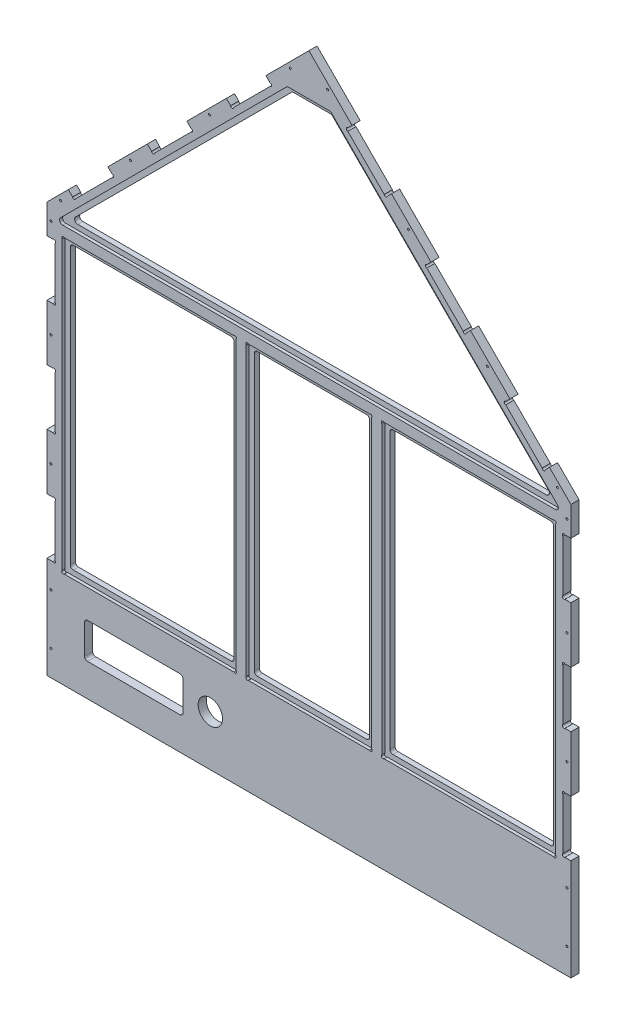
from build123d import *

# Parameters (mm, degrees)
ESQUISSE1_R             = 1
ESQUISSE1_R_2           = 1.000000001
ESQUISSE1_W             = 161.213849546
ESQUISSE1_H             = 276.902031307
ESQUISSE1_W_2           = 113.572300902
ESQUISSE1_W_3           = 161.213849547
BOSS_EXTRU_1_DEPTH      = 8
ENL_V_MAT_EXTRU_1_DEPTH = 3
ESQUISSE4_R             = 12
ENL_V_MAT_EXTRU_2_DEPTH = 8
CONG_2_R                = 3
CONG_3_R                = 3
CONG_4_R                = 3
CONG_5_R                = 3
CONG_6_R                = 3


with BuildPart() as part:
    # Esquisse1 → Boss.-Extru.1 (new body)
    with BuildSketch(Plane.XY):
        with BuildLine():
            Line((-49.894274085, -43.786141437), (466.10572591, -43.786141437))
            Line((466.10572591, -43.786141437), (466.10572591, 56.213858563))
            Line((466.10572591, 56.213858563), (460.227046734, 56.213858563))
            ThreePointArc((460.227046734, 56.213858563), (458.10572639, 56.213858563), (458.10572639, 58.335178907))
            Line((458.10572639, 58.335178907), (458.10572639, 109.09253822))
            ThreePointArc((458.10572639, 109.09253822), (458.10572639, 111.213858563), (460.227046734, 111.213858563))
            Line((460.227046734, 111.213858563), (466.10572591, 111.213858563))
            Line((466.10572591, 111.213858563), (466.10572591, 166.213858563))
            Line((466.10572591, 166.213858563), (460.227046253, 166.213858563))
            ThreePointArc((460.227046253, 166.213858563), (458.10572591, 166.213858563), (458.10572591, 168.335178907))
            Line((458.10572591, 168.335178907), (458.10572591, 219.09253822))
            ThreePointArc((458.10572591, 219.09253822), (458.10572615, 221.213858804), (460.227046734, 221.213858563))
            Line((460.227046734, 221.213858563), (466.10572591, 221.213858563))
            Line((466.10572591, 221.213858563), (466.10572591, 276.213858563))
            Line((466.10572591, 276.213858563), (460.227046734, 276.213858563))
            ThreePointArc((460.227046734, 276.213858563), (458.10573066, 276.213853813), (458.10572591, 278.335169888))
            Line((458.10572591, 278.335169888), (458.10572591, 329.092529201))
            ThreePointArc((458.10572591, 329.092529201), (458.105721641, 331.213854294), (460.227046734, 331.213858563))
            Line((460.227046734, 331.213858563), (466.10572591, 331.213858563))
            Line((466.10572591, 331.213858563), (466.10572591, 360.062028703))
            Line((466.10572591, 360.062028703), (444.986495637, 381.181258976))
            Line((444.986495637, 381.181258976), (440.829641388, 377.024404728))
            ThreePointArc((440.829641388, 377.024404728), (439.329647871, 375.524400218), (437.829643361, 377.024393736))
            Line((437.829643361, 377.024393736), (401.938770396, 412.915266701))
            ThreePointArc((401.938770396, 412.915266701), (400.438763913, 414.415271211), (401.938768423, 415.915277693))
            Line((401.938768423, 415.915277693), (406.095622671, 420.072131942))
            Line((406.095622671, 420.072131942), (367.204749706, 458.963004907))
            Line((367.204749706, 458.963004907), (363.047894347, 454.806149548))
            ThreePointArc((363.047894347, 454.806149548), (361.54790083, 453.306146149), (360.047897431, 454.806139666))
            Line((360.047897431, 454.806139666), (324.157024466, 490.697012632))
            ThreePointArc((324.157024466, 490.697012632), (322.657019956, 492.197016031), (324.157023355, 493.69702054))
            Line((324.157023355, 493.69702054), (328.313878714, 497.853875899))
            Line((328.313878714, 497.853875899), (289.423005749, 536.744748864))
            Line((289.423005749, 536.744748864), (285.266149788, 532.587892903))
            ThreePointArc((285.266149788, 532.587892903), (283.766154297, 531.087890106), (282.2661515, 532.587885597))
            Line((282.2661515, 532.587885597), (246.375278535, 568.478758562))
            ThreePointArc((246.375278535, 568.478758562), (244.875274026, 569.978758802), (246.375274266, 571.478763312))
            Line((246.375274266, 571.478763312), (250.532132783, 575.635621829))
            Line((250.532132783, 575.635621829), (208.105725912, 618.062028701))
            Line((208.105725912, 618.062028701), (165.679319041, 575.635621829))
            Line((165.679319041, 575.635621829), (169.836177559, 571.478763312))
            ThreePointArc((169.836177559, 571.478763312), (171.336177799, 569.978758802), (169.836173289, 568.478758562))
            Line((169.836173289, 568.478758562), (133.945300324, 532.587885597))
            ThreePointArc((133.945300324, 532.587885597), (132.445297527, 531.087890106), (130.945302037, 532.587892903))
            Line((130.945302037, 532.587892903), (126.788446076, 536.744748864))
            Line((126.788446076, 536.744748864), (87.89757311, 497.853875899))
            Line((87.89757311, 497.853875899), (92.054428469, 493.69702054))
            ThreePointArc((92.054428469, 493.69702054), (93.554431868, 492.197016031), (92.054427359, 490.697012632))
            Line((92.054427359, 490.697012632), (56.163554393, 454.806139666))
            ThreePointArc((56.163554393, 454.806139666), (54.663550994, 453.306146149), (53.163557477, 454.806149548))
            Line((53.163557477, 454.806149548), (49.006702118, 458.963004907))
            Line((49.006702118, 458.963004907), (10.115829153, 420.072131942))
            Line((10.115829153, 420.072131942), (14.272683401, 415.915277693))
            ThreePointArc((14.272683401, 415.915277693), (15.772687911, 414.415271211), (14.272681428, 412.915266701))
            Line((14.272681428, 412.915266701), (-21.618191537, 377.024393736))
            ThreePointArc((-21.618191537, 377.024393736), (-23.118196047, 375.524400218), (-24.618189564, 377.024404728))
            Line((-24.618189564, 377.024404728), (-28.775043812, 381.181258976))
            Line((-28.775043812, 381.181258976), (-49.894274085, 360.062028703))
            Line((-49.894274085, 360.062028703), (-49.894274085, 331.213858563))
            Line((-49.894274085, 331.213858563), (-44.01559491, 331.213858563))
            ThreePointArc((-44.01559491, 331.213858563), (-41.894269816, 331.213854294), (-41.894274085, 329.092529201))
            Line((-41.894274085, 329.092529201), (-41.894274085, 278.335169888))
            ThreePointArc((-41.894274085, 278.335169888), (-41.894278835, 276.213853813), (-44.01559491, 276.213858563))
            Line((-44.01559491, 276.213858563), (-49.894274085, 276.213858563))
            Line((-49.894274085, 276.213858563), (-49.894274085, 221.213858563))
            Line((-49.894274085, 221.213858563), (-44.01559491, 221.213858563))
            ThreePointArc((-44.01559491, 221.213858563), (-41.894274326, 221.213858804), (-41.894274085, 219.09253822))
            Line((-41.894274085, 219.09253822), (-41.894274085, 168.335178907))
            ThreePointArc((-41.894274085, 168.335178907), (-41.894274085, 166.213858563), (-44.015594429, 166.213858563))
            Line((-44.015594429, 166.213858563), (-49.894274085, 166.213858563))
            Line((-49.894274085, 166.213858563), (-49.894274085, 111.213858563))
            Line((-49.894274085, 111.213858563), (-44.01559491, 111.213858563))
            ThreePointArc((-44.01559491, 111.213858563), (-41.894274566, 111.213858563), (-41.894274566, 109.09253822))
            Line((-41.894274566, 109.09253822), (-41.894274566, 58.335178907))
            ThreePointArc((-41.894274566, 58.335178907), (-41.894274566, 56.213858563), (-44.01559491, 56.213858563))
            Line((-44.01559491, 56.213858563), (-49.894274085, 56.213858563))
            Line((-49.894274085, 56.213858563), (-49.894274085, -43.786141437))
        make_face()
        with Locations((462.105725669, 31.213858563)):
            Circle(ESQUISSE1_R, mode=Mode.SUBTRACT)
        with Locations((462.105725669, 138.713858563)):
            Circle(ESQUISSE1_R, mode=Mode.SUBTRACT)
        with Locations((462.105725669, 248.713858563)):
            Circle(ESQUISSE1_R, mode=Mode.SUBTRACT)
        with Locations((462.105725669, 345.637943633)):
            Circle(ESQUISSE1_R, mode=Mode.SUBTRACT)
        with Locations(Location((462.105725669, -18.786141437, 0), (0, 0, 180))):
            Circle(ESQUISSE1_R, mode=Mode.SUBTRACT)
        with Locations(Location((-45.894273845, 345.637943633, 0), (0, 0, 180))):
            Circle(ESQUISSE1_R, mode=Mode.SUBTRACT)
        with Locations(Location((-45.894273845, 248.713858563, 0), (0, 0, 180))):
            Circle(ESQUISSE1_R, mode=Mode.SUBTRACT)
        with Locations(Location((-45.894273845, 138.713858563, 0), (0, 0, 180))):
            Circle(ESQUISSE1_R, mode=Mode.SUBTRACT)
        with Locations(Location((-45.894273845, 31.213858563, 0), (0, 0, 180))):
            Circle(ESQUISSE1_R, mode=Mode.SUBTRACT)
        with Locations((-45.894273845, -18.786141437)):
            Circle(ESQUISSE1_R, mode=Mode.SUBTRACT)
        with Locations((226.490502223, 594.02039814)):
            Circle(ESQUISSE1_R, mode=Mode.SUBTRACT)
        with Locations((306.040015107, 514.470885257)):
            Circle(ESQUISSE1_R_2, mode=Mode.SUBTRACT)
        with Locations((383.821759064, 436.689141299)):
            Circle(ESQUISSE1_R, mode=Mode.SUBTRACT)
        with Locations((452.717683648, 367.793216715)):
            Circle(ESQUISSE1_R, mode=Mode.SUBTRACT)
        with Locations(Location((189.720949601, 594.02039814, 0), (0, 0, 180))):
            Circle(ESQUISSE1_R, mode=Mode.SUBTRACT)
        with Locations(Location((110.171436718, 514.470885257, 0), (0, 0, 180))):
            Circle(ESQUISSE1_R_2, mode=Mode.SUBTRACT)
        with Locations(Location((32.38969276, 436.689141299, 0), (0, 0, 180))):
            Circle(ESQUISSE1_R, mode=Mode.SUBTRACT)
        with Locations(Location((-36.506231824, 367.793216715, 0), (0, 0, 180))):
            Circle(ESQUISSE1_R, mode=Mode.SUBTRACT)
        Polygon((-29.894274085, 353.11588987), (188.839298403, 571.849462359), (227.372153421, 571.849462359), (446.10572591, 353.11588987), align=None, mode=Mode.SUBTRACT)
        with Locations((50.712650688, 194.664874217)):
            Rectangle(ESQUISSE1_W, ESQUISSE1_H, mode=Mode.SUBTRACT)
        with Locations((208.105725912, 194.664874217)):
            Rectangle(ESQUISSE1_W_2, ESQUISSE1_H, mode=Mode.SUBTRACT)
        with Locations((365.498801136, 194.664874217)):
            Rectangle(ESQUISSE1_W_3, ESQUISSE1_H, mode=Mode.SUBTRACT)
    extrude(amount=BOSS_EXTRU_1_DEPTH)

    # Esquisse3 → Enlèv. mat.-Extru.1 (cut)
    with BuildSketch(Plane.XY.offset(8)):
        with BuildLine():
            Line((-32.772954223, 338.11588987), (134.198254636, 338.11588987))
            ThreePointArc((134.198254636, 338.11588987), (136.31957522, 338.115890111), (136.319575461, 335.994569527))
            Line((136.319575461, 335.994569527), (136.319575461, 53.335169888))
            ThreePointArc((136.319575461, 53.335169888), (136.319570711, 51.213853813), (134.198254636, 51.213858563))
            Line((134.198254636, 51.213858563), (-32.772954223, 51.213858563))
            ThreePointArc((-32.772954223, 51.213858563), (-34.894269816, 51.213854294), (-34.894274085, 53.335169888))
            Line((-34.894274085, 53.335169888), (-34.894274085, 335.994569527))
            ThreePointArc((-34.894274085, 335.994569527), (-34.894274326, 338.11588963), (-32.772954223, 338.11588987))
        make_face()
        with BuildLine():
            Line((451.10572591, 335.994569527), (451.10572591, 53.335169888))
            ThreePointArc((451.10572591, 53.335169888), (451.10572164, 51.213854294), (448.984406047, 51.213858563))
            Line((448.984406047, 51.213858563), (282.013196226, 51.213858563))
            ThreePointArc((282.013196226, 51.213858563), (279.891880633, 51.213854294), (279.891876363, 53.335169888))
            Line((279.891876363, 53.335169888), (279.891876363, 335.994569527))
            ThreePointArc((279.891876363, 335.994569527), (279.891876123, 338.11588963), (282.013196226, 338.11588987))
            Line((282.013196226, 338.11588987), (448.984406047, 338.11588987))
            ThreePointArc((448.984406047, 338.11588987), (451.10572615, 338.11588963), (451.10572591, 335.994569527))
        make_face()
        Polygon((186.76823011, 576.849462359), (229.443221714, 576.849462359), (457.917250657, 348.115889869), (-41.705798832, 348.115889869), align=None)
        with BuildLine():
            Line((146.319575461, 335.994569527), (146.319575461, 53.335169888))
            ThreePointArc((146.319575461, 53.335169888), (146.31957973, 51.213854294), (148.440895324, 51.213858563))
            Line((148.440895324, 51.213858563), (267.770555539, 51.213858563))
            ThreePointArc((267.770555539, 51.213858563), (269.891871613, 51.213853813), (269.891876363, 53.335169888))
            Line((269.891876363, 53.335169888), (269.891876363, 335.994569527))
            ThreePointArc((269.891876363, 335.994569527), (269.891876123, 338.115890111), (267.770555539, 338.11588987))
            Line((267.770555539, 338.11588987), (148.440895324, 338.11588987))
            ThreePointArc((148.440895324, 338.11588987), (146.31957522, 338.11588963), (146.319575461, 335.994569527))
        make_face()
    extrude(amount=-ENL_V_MAT_EXTRU_1_DEPTH, mode=Mode.SUBTRACT)

    # Esquisse4 → Enlèv. mat.-Extru.2 (cut)
    with BuildSketch(Plane(origin=(0, 0, 0), x_dir=(-1, 0, 0), z_dir=(0, 0, -1))):
        with Locations((-111.018113412, 5.713858563)):
            Circle(ESQUISSE4_R)
        with BuildLine():
            Line((9.891886588, -11.786141437), (-81.108113412, -11.786141437))
            ThreePointArc((-81.108113412, -11.786141437), (-83.229433756, -10.90746178), (-84.108113412, -8.786141437))
            Line((-84.108113412, -8.786141437), (-84.108113412, 20.213858563))
            ThreePointArc((-84.108113412, 20.213858563), (-83.229433756, 22.335178907), (-81.108113412, 23.213858563))
            Line((-81.108113412, 23.213858563), (9.891886588, 23.213858563))
            ThreePointArc((9.891886588, 23.213858563), (12.013206932, 22.335178907), (12.891886588, 20.213858563))
            Line((12.891886588, 20.213858563), (12.891886588, -8.786141437))
            ThreePointArc((12.891886588, -8.786141437), (12.013206932, -10.90746178), (9.891886588, -11.786141437))
        make_face()
    extrude(amount=-ENL_V_MAT_EXTRU_2_DEPTH, mode=Mode.SUBTRACT)

    # Congé2
    cong_2_edges = [part.edges().sort_by_distance(p)[0] for p in [
        (-41.705798832, 348.115889869, 6.5),
    ]]
    fillet(cong_2_edges, radius=CONG_2_R)

    # Congé3
    cong_3_edges = [part.edges().sort_by_distance(p)[0] for p in [
        (457.917250657, 348.115889869, 6.5),
    ]]
    fillet(cong_3_edges, radius=CONG_3_R)

    # Congé4
    cong_4_edges = [part.edges().sort_by_distance(p)[0] for p in [
        (-29.894274085, 333.11588987, 2.5),
        (-29.894274085, 56.213858563, 2.5),
        (131.319575461, 333.11588987, 2.5),
        (131.319575461, 56.213858563, 2.5),
        (284.891876363, 333.11588987, 2.5),
        (284.891876363, 56.213858563, 2.5),
        (446.10572591, 333.11588987, 2.5),
        (446.10572591, 56.213858563, 2.5),
        (264.891876363, 56.213858563, 2.5),
        (264.891876363, 333.11588987, 2.5),
        (151.319575461, 56.213858563, 2.5),
        (151.319575461, 333.11588987, 2.5),
    ]]
    fillet(cong_4_edges, radius=CONG_4_R)

    # Congé5
    cong_5_edges = [part.edges().sort_by_distance(p)[0] for p in [
        (-29.894274085, 353.11588987, 2.5),
        (446.10572591, 353.11588987, 2.5),
    ]]
    fillet(cong_5_edges, radius=CONG_5_R)

    # Congé6
    cong_6_edges = [part.edges().sort_by_distance(p)[0] for p in [
        (188.839298403, 571.849462359, 2.5),
        (227.372153421, 571.849462359, 2.5),
    ]]
    fillet(cong_6_edges, radius=CONG_6_R)


solid = part.part
